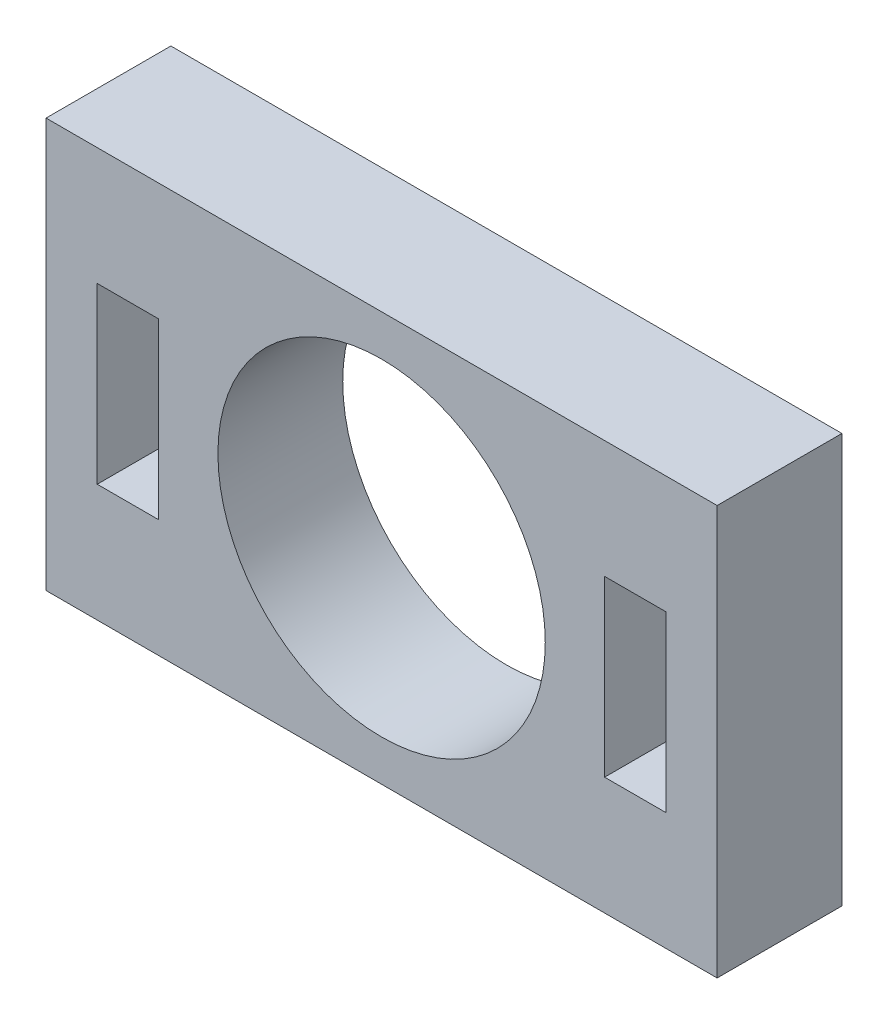
from build123d import *

# Parameters (mm, degrees)
SKETCH1_W           = 32.8
SKETCH1_H           = 20
SKETCH1_R           = 8
SKETCH1_W_2         = 3
SKETCH1_H_2         = 8.5
BOSS_EXTRUDE1_DEPTH = 6.1


with BuildPart() as part:
    # Sketch1 → Boss-Extrude1 (new body)
    with BuildSketch(Plane.XY):
        Rectangle(SKETCH1_W, SKETCH1_H)
        Circle(SKETCH1_R, mode=Mode.SUBTRACT)
        with Locations((12.4, 0)):
            Rectangle(SKETCH1_W_2, SKETCH1_H_2, mode=Mode.SUBTRACT)
        with Locations((-12.4, 0)):
            Rectangle(SKETCH1_W_2, SKETCH1_H_2, mode=Mode.SUBTRACT)
    extrude(amount=BOSS_EXTRUDE1_DEPTH)


solid = part.part
